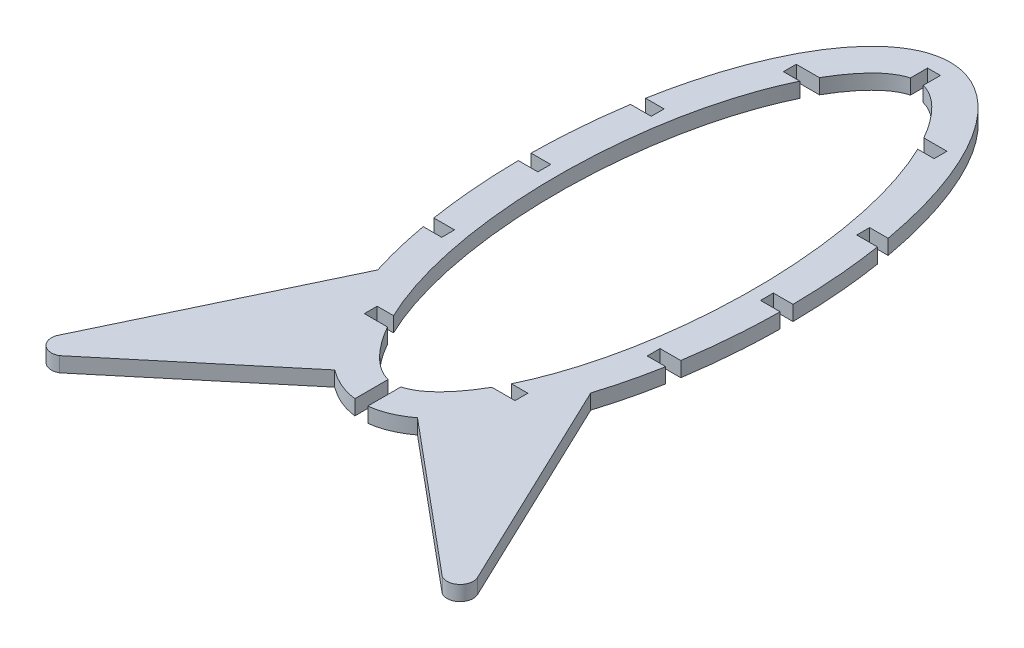
from build123d import *

# Parameters (mm, degrees)
BOSS_EXTRUDE1_DEPTH = 2.8956


with BuildPart() as part:
    # Sketch1 → Boss-Extrude1 (new body)
    with BuildSketch(Plane(origin=(0, 0, 0), x_dir=(1, 0, 0), z_dir=(0, 1, 0))):
        with BuildLine():
            Line((21.59, 1.2446), (25.393976036, 1.2446))
            add(Edge.make_bspline(
                [(25.393976036, 1.2446), (25.305125525, 10.422131382), (23.943355437, 19.0754)],
                knots=[4.73416848, 4.73416848, 4.73416848, 5.052697334, 5.052697334, 5.052697334], degree=2, weights=[1, 0.987344206, 1]))
            Line((23.943355437, 19.0754), (19.930240776, 19.0754))
            Line((19.930240776, 19.0754), (19.930240776, 21.5646))
            Line((19.930240776, 21.5646), (23.522368768, 21.5646))
            add(Edge.make_bspline(
                [(23.522368768, 21.5646), (0, 151.457597173), (-23.522368768, 21.5646)],
                knots=[5.099304053, 5.099304053, 5.099304053, 7.467066561, 7.467066561, 7.467066561], degree=2, weights=[1, 0.377333333, 1]))
            Line((-23.522368768, 21.5646), (-19.930240776, 21.5646))
            Line((-19.930240776, 21.5646), (-19.930240776, 19.0754))
            Line((-19.930240776, 19.0754), (-23.943355437, 19.0754))
            add(Edge.make_bspline(
                [(-23.943355437, 19.0754), (-25.305125525, 10.422131382), (-25.393976036, 1.2446)],
                knots=[1.230487974, 1.230487974, 1.230487974, 1.549016827, 1.549016827, 1.549016827], degree=2, weights=[1, 0.987344206, 1]))
            Line((-25.393976036, 1.2446), (-21.59, 1.2446))
            Line((-21.59, 1.2446), (-21.59, -1.2446))
            Line((-21.59, -1.2446), (-25.393976036, -1.2446))
            add(Edge.make_bspline(
                [(-25.393976036, -1.2446), (-25.305125525, -10.422131382), (-23.943355437, -19.0754)],
                knots=[1.592575826, 1.592575826, 1.592575826, 1.91110468, 1.91110468, 1.91110468], degree=2, weights=[1, 0.987344206, 1]))
            Line((-23.943355437, -19.0754), (-19.930240776, -19.0754))
            Line((-19.930240776, -19.0754), (-19.930240776, -21.5646))
            Line((-19.930240776, -21.5646), (-23.522368768, -21.5646))
            add(Edge.make_bspline(
                [(-23.522368768, -21.5646), (-22.395811131, -27.785569894), (-20.658836503, -33.249220312)],
                knots=[1.957711399, 1.957711399, 1.957711399, 2.191722412, 2.191722412, 2.191722412], degree=2, weights=[1, 0.993162662, 1]))
            Line((-20.658836503, -33.249220312), (-40.656934115, -75.189915873))
            ThreePointArc((-40.656934115, -75.189915873), (-40.089838211, -78.146952179), (-37.097948163, -78.484969079))
            Line((-37.097948163, -78.484969079), (-8.029094451, -54.219568092))
            add(Edge.make_bspline(
                [(-8.029094451, -54.219568092), (-4.724069079, -56.697277371), (-1.2446, -57.081350193)],
                knots=[2.819970364, 2.819970364, 2.819970364, 3.092573024, 3.092573024, 3.092573024], degree=2, weights=[1, 0.990725346, 1]))
            Line((-1.2446, -57.081350193), (-1.2446, -53.975))
            Line((-1.2446, -53.975), (-1.2446, -50.644928526))
            add(Edge.make_bspline(
                [(-1.2446, -50.644928526), (-1.592566722, -50.559021859), (-2.797472305, -50.153191319), (-5.318112389, -48.514264833), (-8.117471478, -45.20633596), (-9.696301311, -42.637606864), (-10.124198394, -41.884600001)],
                knots=[-3.032554281, -3.032554281, -3.032554281, -3.032554281, -2.945243113, -2.748893572, -2.552544031, -2.478028469, -2.478028469, -2.478028469, -2.478028469], degree=3))
            Line((-10.124198394, -41.884600001), (-14.613224312, -41.884600001))
            Line((-14.613224312, -41.884600001), (-14.613224312, -39.395400001))
            Line((-14.613224312, -39.395400001), (-11.431305901, -39.395400001))
            add(Edge.make_bspline(
                [(-11.431305901, -39.395400001), (-11.677149239, -38.889598832), (-12.987812642, -36.070874709), (-15.148196965, -30.166196648), (-18.099752632, -17.775460251), (-19.683498245, 0), (-18.099752632, 17.775460251), (-15.148196965, 30.166196648), (-12.987812642, 36.070874709), (-11.677149239, 38.889598832), (-11.431305901, 39.395400001)],
                knots=[-2.400745736, -2.400745736, -2.400745736, -2.400745736, -2.35619449, -2.159844949, -1.963495408, -1.570796327, -1.178097245, -0.981747704, -0.785398163, -0.740846918, -0.740846918, -0.740846918, -0.740846918], degree=3))
            Line((-11.431305901, 39.395400001), (-14.613224312, 39.395400001))
            Line((-14.613224312, 39.395400001), (-14.613224312, 41.884600001))
            Line((-14.613224312, 41.884600001), (-10.124198394, 41.884600001))
            add(Edge.make_bspline(
                [(-10.124198394, 41.884600001), (-9.696301311, 42.637606864), (-8.117471478, 45.20633596), (-5.318112389, 48.514264833), (-2.797472305, 50.153191319), (-1.592566722, 50.559021859), (-1.2446, 50.644928526)],
                knots=[-0.663564185, -0.663564185, -0.663564185, -0.663564185, -0.589048623, -0.392699082, -0.196349541, -0.109038372, -0.109038372, -0.109038372, -0.109038372], degree=3))
            Line((-1.2446, 50.644928526), (-1.2446, 53.975))
            Line((-1.2446, 53.975), (1.2446, 53.975))
            Line((1.2446, 53.975), (1.2446, 50.644928526))
            add(Edge.make_bspline(
                [(10.124198394, 41.884600001), (9.696301311, 42.637606864), (8.117471478, 45.20633596), (5.318112389, 48.514264833), (2.797472305, 50.153191319), (1.592566722, 50.559021859), (1.2446, 50.644928526)],
                knots=[-0.663564185, -0.663564185, -0.663564185, -0.663564185, -0.589048623, -0.392699082, -0.196349541, -0.109038372, -0.109038372, -0.109038372, -0.109038372], degree=3))
            Line((10.124198394, 41.884600001), (14.613224312, 41.884600001))
            Line((14.613224312, 41.884600001), (14.613224312, 39.395400001))
            Line((14.613224312, 39.395400001), (11.431305901, 39.395400001))
            add(Edge.make_bspline(
                [(11.431305901, -39.395400001), (11.677149239, -38.889598832), (12.987812642, -36.070874709), (15.148196965, -30.166196648), (18.099752632, -17.775460251), (19.683498245, 0), (18.099752632, 17.775460251), (15.148196965, 30.166196648), (12.987812642, 36.070874709), (11.677149239, 38.889598832), (11.431305901, 39.395400001)],
                knots=[-2.400745736, -2.400745736, -2.400745736, -2.400745736, -2.35619449, -2.159844949, -1.963495408, -1.570796327, -1.178097245, -0.981747704, -0.785398163, -0.740846918, -0.740846918, -0.740846918, -0.740846918], degree=3))
            Line((11.431305901, -39.395400001), (14.613224312, -39.395400001))
            Line((14.613224312, -39.395400001), (14.613224312, -41.884600001))
            Line((14.613224312, -41.884600001), (10.124198394, -41.884600001))
            add(Edge.make_bspline(
                [(1.2446, -50.644928526), (1.592566722, -50.559021859), (2.797472305, -50.153191319), (5.318112389, -48.514264833), (8.117471478, -45.20633596), (9.696301311, -42.637606864), (10.124198394, -41.884600001)],
                knots=[-3.032554281, -3.032554281, -3.032554281, -3.032554281, -2.945243113, -2.748893572, -2.552544031, -2.478028469, -2.478028469, -2.478028469, -2.478028469], degree=3))
            Line((1.2446, -50.644928526), (1.2446, -53.975))
            Line((1.2446, -53.975), (1.2446, -57.081350193))
            add(Edge.make_bspline(
                [(1.2446, -57.081350193), (4.724069079, -56.697277371), (8.029094451, -54.219568092)],
                knots=[3.190612283, 3.190612283, 3.190612283, 3.463214943, 3.463214943, 3.463214943], degree=2, weights=[1, 0.990725346, 1]))
            Line((8.029094451, -54.219568092), (37.097948163, -78.484969079))
            ThreePointArc((37.097948163, -78.484969079), (40.089838211, -78.146952179), (40.656934115, -75.189915873))
            Line((40.656934115, -75.189915873), (20.658836503, -33.249220312))
            add(Edge.make_bspline(
                [(20.658836503, -33.249220312), (22.395811131, -27.785569894), (23.522368768, -21.5646)],
                knots=[4.091462895, 4.091462895, 4.091462895, 4.325473908, 4.325473908, 4.325473908], degree=2, weights=[1, 0.993162662, 1]))
            Line((23.522368768, -21.5646), (19.930240776, -21.5646))
            Line((19.930240776, -21.5646), (19.930240776, -19.0754))
            Line((19.930240776, -19.0754), (23.943355437, -19.0754))
            add(Edge.make_bspline(
                [(23.943355437, -19.0754), (25.305125525, -10.422131382), (25.393976036, -1.2446)],
                knots=[4.372080627, 4.372080627, 4.372080627, 4.690609481, 4.690609481, 4.690609481], degree=2, weights=[1, 0.987344206, 1]))
            Line((25.393976036, -1.2446), (21.59, -1.2446))
            Line((21.59, -1.2446), (21.59, 1.2446))
        make_face()
    extrude(amount=BOSS_EXTRUDE1_DEPTH)


solid = part.part
